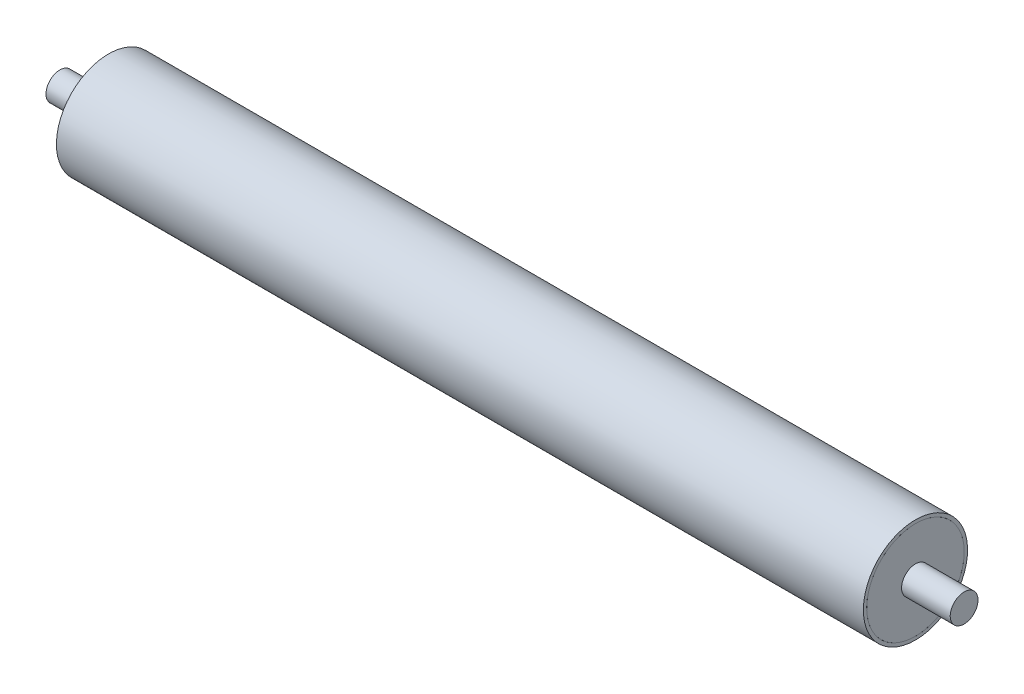
from build123d import *

# Parameters (mm, degrees)
SKETCH1_W           = 580.6
SKETCH1_H           = 2.3995
SKETCH2_R           = 35.1
SKETCH2_R_2         = 10.0005
BOSS_EXTRUDE1_DEPTH = 10
SKETCH3_R           = 35.1
SKETCH3_R_2         = 10.0005
BOSS_EXTRUDE2_DEPTH = 10
SKETCH4_W           = 650.6
SKETCH4_H           = 10


with BuildPart() as part:
    # Sketch1 → Revolve1 (revolve)
    with BuildSketch(Plane.XY, mode=Mode.PRIVATE) as revolve1_sk:
        with Locations((0, 36.30025)):
            Rectangle(SKETCH1_W, SKETCH1_H)
    revolve(revolve1_sk.sketch.rotate(Axis((-290.3, 0, 0), (1, 0, 0)), 180), axis=Axis((-290.3, 0, 0), (1, 0, 0)))


with BuildPart() as body_2:
    # Sketch2 → Boss-Extrude1 (new body)
    with BuildSketch(Plane.ZY.offset(290.3)):
        with Locations(Location((0, 0, 0), (0, 0, 270))):
            Circle(SKETCH2_R)
        with Locations(Location((0, 0, 0), (0, 0, 270))):
            Circle(SKETCH2_R_2, mode=Mode.SUBTRACT)
    extrude(amount=-BOSS_EXTRUDE1_DEPTH)


with BuildPart() as body_3:
    # Sketch3 → Boss-Extrude2 (new body)
    with BuildSketch(Plane(origin=(290.3, 0, 0), x_dir=(0, 0, -1), z_dir=(1, 0, 0))):
        with Locations(Location((0, 0, 0), (0, 0, 90))):
            Circle(SKETCH3_R)
        with Locations(Location((0, 0, 0), (0, 0, 90))):
            Circle(SKETCH3_R_2, mode=Mode.SUBTRACT)
    extrude(amount=-BOSS_EXTRUDE2_DEPTH)


with BuildPart() as body_4:
    # Sketch4 → Revolve3 (revolve)
    with BuildSketch(Plane.XY, mode=Mode.PRIVATE) as revolve3_sk:
        with Locations((0, 5)):
            Rectangle(SKETCH4_W, SKETCH4_H)
    revolve(revolve3_sk.sketch.rotate(Axis((-325.3, 0, 0), (1, 0, 0)), 180), axis=Axis((-325.3, 0, 0), (1, 0, 0)))


solid = Compound([part.part, body_2.part, body_3.part, body_4.part])
